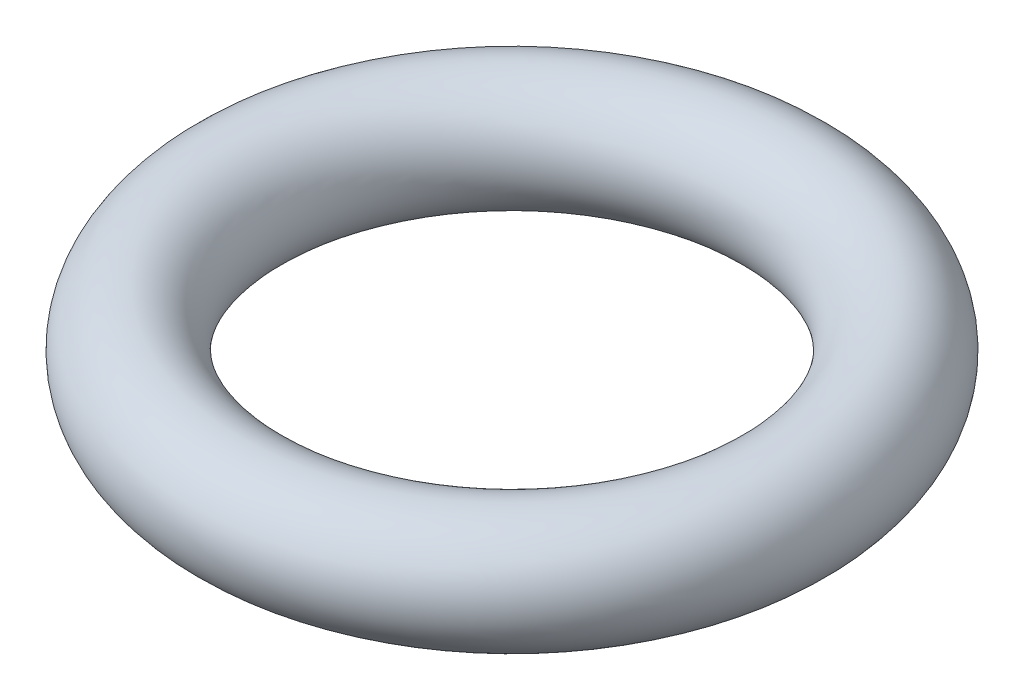
from build123d import *

# Parameters (mm, degrees)
ESBO_O1_R = 15
ESBO_O2_R = 10


with BuildPart() as part:
    # Esboço1 → Revolução1 (revolve)
    with BuildSketch(Plane(origin=(0, 0, 0), x_dir=(0, 0, -1), z_dir=(1, 0, 0)), mode=Mode.PRIVATE) as revolu_o1_sk:
        with Locations((-70, 0)):
            Circle(ESBO_O1_R)
    revolve(revolu_o1_sk.sketch.rotate(Axis((0, 0, 0), (0, 1, 0)), 180), axis=Axis((0, 0, 0), (0, 1, 0)))

    # Esboço2 → Corte-Revolução1 (revolve, cut)
    with BuildSketch(Plane(origin=(0, 0, 0), x_dir=(0, 0, -1), z_dir=(1, 0, 0)), mode=Mode.PRIVATE) as corte_revolu_o1_sk:
        with Locations((-70, 0)):
            Circle(ESBO_O2_R)
    revolve(corte_revolu_o1_sk.sketch.rotate(Axis((0, 0, 0), (0, 1, 0)), 180), axis=Axis((0, 0, 0), (0, 1, 0)), mode=Mode.SUBTRACT)


solid = part.part
